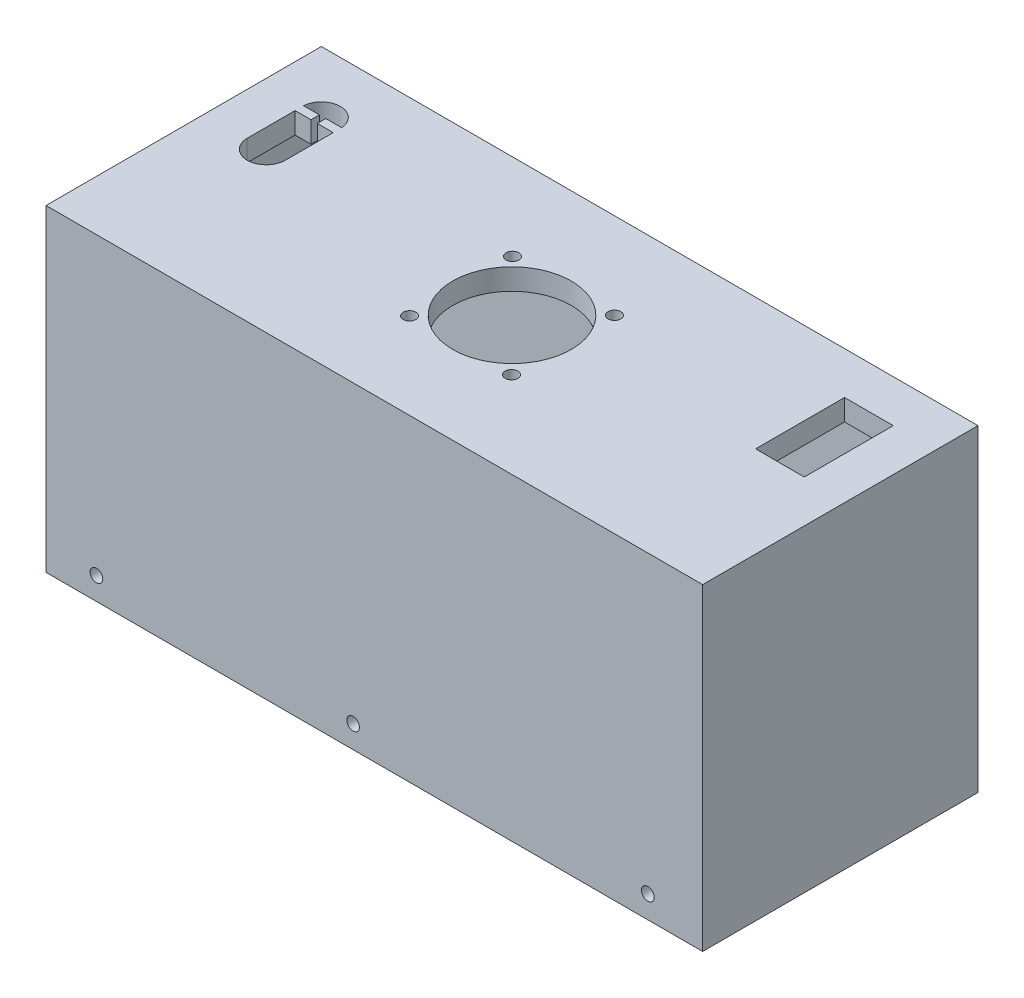
from build123d import *

# Parameters (mm, degrees)
SKETCH1_W           = 155
SKETCH1_H           = 65
BOSS_EXTRUDE2_DEPTH = 75
SKETCH2_W           = 145
SKETCH2_H           = 55
CUT_EXTRUDE1_DEPTH  = 70
SKETCH3_R           = 14
SKETCH3_R_2         = 1.5
SKETCH3_W           = 11.5
SKETCH3_H           = 21
CUT_EXTRUDE2_DEPTH  = 70
SKETCH5_R           = 1.5
CUT_EXTRUDE3_DEPTH  = 73
SKETCH6_W           = 3.75
SKETCH6_H           = 2
BOSS_EXTRUDE3_DEPTH = 5


with BuildPart() as part:
    # Sketch1 → Boss-Extrude2 (new body)
    with BuildSketch(Plane(origin=(0, 0, 0), x_dir=(1, 0, 0), z_dir=(0, 1, 0))):
        with Locations((-63.409090909, -25.909090909)):
            Rectangle(SKETCH1_W, SKETCH1_H)
    extrude(amount=BOSS_EXTRUDE2_DEPTH)

    # Sketch2 → Cut-Extrude1 (cut)
    with BuildSketch(Plane.XZ):
        with Locations((-63.409090909, 25.909090909)):
            Rectangle(SKETCH2_W, SKETCH2_H)
    extrude(amount=-CUT_EXTRUDE1_DEPTH, mode=Mode.SUBTRACT)

    # Sketch3 → Cut-Extrude2 (cut)
    with BuildSketch(Plane(origin=(0, 75, 0), x_dir=(1, 0, 0), z_dir=(0, 1, 0))):
        with Locations(Location((-63.480160731, -25.837348529, 0), (0, 0, 270))):
            Circle(SKETCH3_R)
        with Locations(Location((-75.444232667, -13.760056502, 0), (0, 0, 270))):
            Circle(SKETCH3_R_2)
        with Locations(Location((-51.373949151, -13.760056502, 0), (0, 0, 90))):
            Circle(SKETCH3_R_2)
        with Locations(Location((-51.373949151, -38.058125316, 0), (0, 0, 270))):
            Circle(SKETCH3_R_2)
        with Locations(Location((-75.444232667, -38.058125316, 0), (0, 0, 90))):
            Circle(SKETCH3_R_2)
        with BuildLine():
            Line((-121.909090909, -7.909090909), (-121.909090909, -20.909090909))
            ThreePointArc((-121.909090909, -20.909090909), (-126.409090909, -25.409090909), (-130.909090909, -20.909090909))
            Line((-130.909090909, -20.909090909), (-130.909090909, -7.909090909))
            ThreePointArc((-130.909090909, -7.909090909), (-126.409090909, -3.409090909), (-121.909090909, -7.909090909))
        make_face()
        with Locations((-1.659090909, -13.909090909)):
            Rectangle(SKETCH3_W, SKETCH3_H)
    extrude(amount=-CUT_EXTRUDE2_DEPTH, mode=Mode.SUBTRACT)

    # Sketch5 → Cut-Extrude3 (cut)
    with BuildSketch(Plane.XY.offset(58.409090909)):
        with Locations((-68.4120524, 5.312033368)):
            Circle(SKETCH5_R)
        with Locations((1.156357058, 5.323906477)):
            Circle(SKETCH5_R)
        with Locations((-129.008167682, 5.312033368)):
            Circle(SKETCH5_R)
    extrude(amount=-CUT_EXTRUDE3_DEPTH, mode=Mode.SUBTRACT)

    # Sketch6 → Boss-Extrude3 (add)
    with BuildSketch(Plane(origin=(0, 75, 0), x_dir=(1, 0, 0), z_dir=(0, 1, 0))):
        with Locations((-129.034090909, -8.609090909)):
            Rectangle(SKETCH6_W, SKETCH6_H)
        with Locations((-123.784090909, -8.609090909)):
            Rectangle(SKETCH6_W, SKETCH6_H)
    extrude(amount=-BOSS_EXTRUDE3_DEPTH)


solid = part.part
